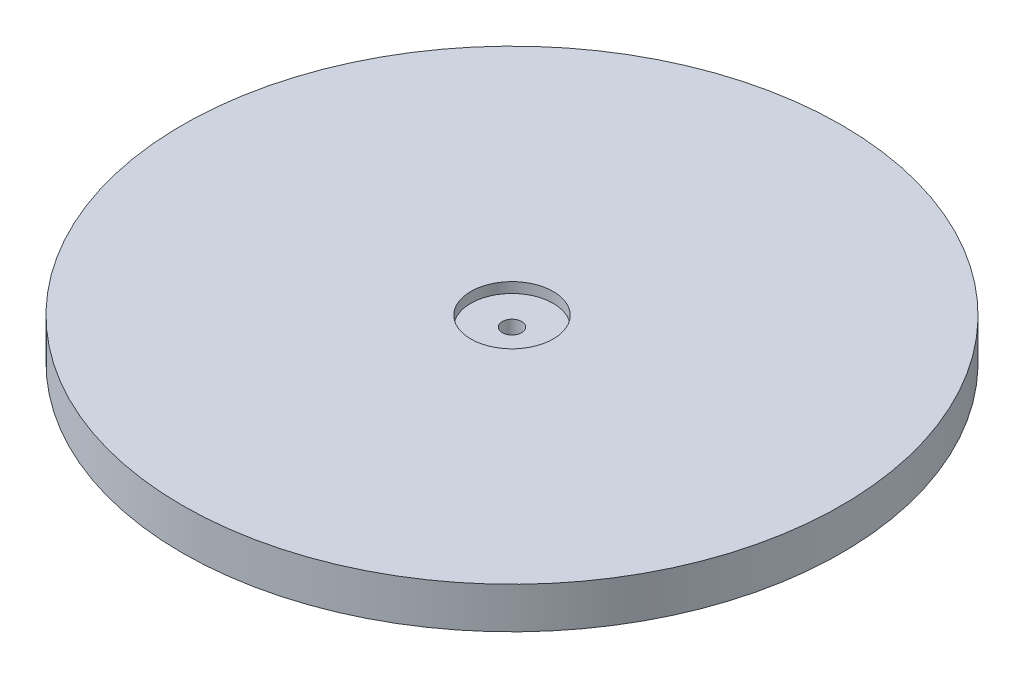
from build123d import *

# Parameters (mm, degrees)
SKETCH1_R           = 101.6
SKETCH1_R_2         = 3
BOSS_EXTRUDE1_DEPTH = 12.7
SKETCH7_R           = 101.6
SKETCH7_R_2         = 3
BOSS_EXTRUDE3_DEPTH = 6.35
SKETCH8_R           = 12.7
CUT_EXTRUDE1_DEPTH  = 6.35
CUT_EXTRUDE2_START  = -6.35
SKETCH9_R           = 12.7
CUT_EXTRUDE2_DEPTH  = 6.35
SKETCH10_R          = 101.6
CUT_EXTRUDE3_DEPTH  = 6.35
BOSS_EXTRUDE4_START = 3.175
SKETCH12_R          = 12.7
BOSS_EXTRUDE4_DEPTH = 3.175
SKETCH13_R          = 3
CUT_EXTRUDE6_DEPTH  = 3.175


with BuildPart() as part:
    # Sketch1 → Boss-Extrude1 (new body)
    with BuildSketch(Plane(origin=(0, 0, 0), x_dir=(1, 0, 0), z_dir=(0, 1, 0))):
        with Locations(Location((0, 0, 0), (0, 0, 270))):
            Circle(SKETCH1_R)
        with Locations(Location((0, 0, 0), (0, 0, 270))):
            Circle(SKETCH1_R_2, mode=Mode.SUBTRACT)
    extrude(amount=BOSS_EXTRUDE1_DEPTH)

    # Sketch7 → Boss-Extrude3 (add)
    with BuildSketch(Plane(origin=(0, 12.7, 0), x_dir=(1, 0, 0), z_dir=(0, 1, 0))):
        with Locations(Location((0, 0, 0), (0, 0, 270))):
            Circle(SKETCH7_R)
        with Locations(Location((0, 0, 0), (0, 0, 270))):
            Circle(SKETCH7_R_2, mode=Mode.SUBTRACT)
    extrude(amount=BOSS_EXTRUDE3_DEPTH)

    # Sketch8 → Cut-Extrude1 (cut)
    with BuildSketch(Plane(origin=(0, 19.05, 0), x_dir=(1, 0, 0), z_dir=(0, 1, 0))):
        with Locations(Location((0, 0, 0), (0, 0, 270))):
            Circle(SKETCH8_R)
    extrude(amount=-CUT_EXTRUDE1_DEPTH, mode=Mode.SUBTRACT)

    # Sketch9 → Cut-Extrude2 (cut)
    with BuildSketch(Plane.XZ.offset(CUT_EXTRUDE2_START)):
        with Locations(Location((0, 0, 0), (0, 0, 90))):
            Circle(SKETCH9_R)
    extrude(amount=CUT_EXTRUDE2_DEPTH, mode=Mode.SUBTRACT)

    # Sketch10 → Cut-Extrude3 (cut)
    with BuildSketch(Plane.XZ):
        with Locations(Location((0, 0, 0), (0, 0, 270))):
            Circle(SKETCH10_R)
    extrude(amount=-CUT_EXTRUDE3_DEPTH, mode=Mode.SUBTRACT)

    # Sketch12 → Boss-Extrude4 (add)
    with BuildSketch(Plane(origin=(0, 12.7, 0), x_dir=(1, 0, 0), z_dir=(0, 1, 0)).offset(BOSS_EXTRUDE4_START)):
        with Locations(Location((0, 0, 0), (0, 0, 270))):
            Circle(SKETCH12_R)
    extrude(amount=-BOSS_EXTRUDE4_DEPTH)

    # Sketch13 → Cut-Extrude6 (cut)
    with BuildSketch(Plane.XZ.offset(-12.7)):
        with Locations(Location((0, 0, 0), (0, 0, 270))):
            Circle(SKETCH13_R)
    extrude(amount=-CUT_EXTRUDE6_DEPTH, mode=Mode.SUBTRACT)


solid = part.part
